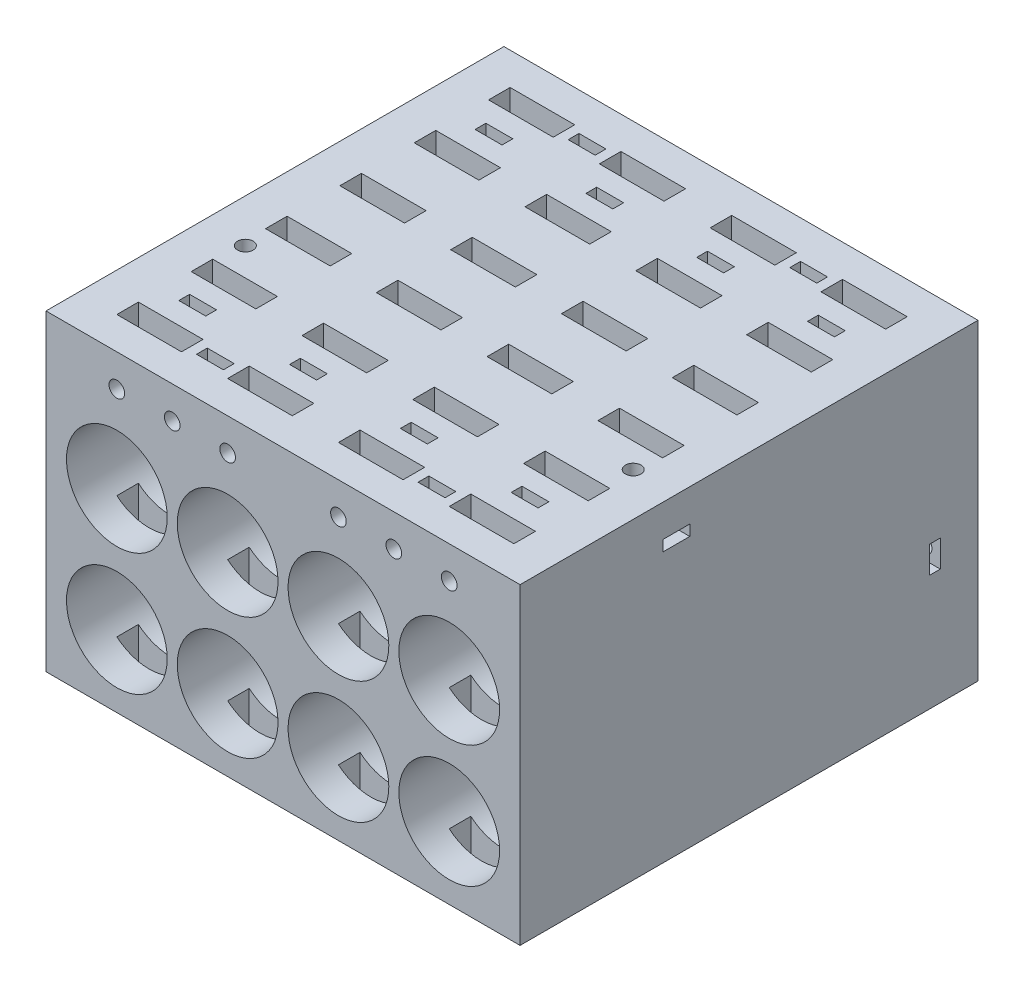
from build123d import *

# Parameters (mm, degrees)
SKETCH1_W                       = 88
SKETCH1_H                       = 58
BOSS_EXTRUDE1_DEPTH             = 10
SKETCH2_W                       = 88
SKETCH2_H                       = 58
SKETCH2_R                       = 9.35
BOSS_EXTRUDE2_DEPTH             = 75
SKETCH3_W                       = 12
SKETCH3_H                       = 4
CUT_EXTRUDE1_DEPTH              = 136.399409157
M2_5_CLEARANCE_HOLE1_D          = 2.9
M2_5_CLEARANCE_HOLE1_DEPTH      = 22
M2_5_CLEARANCE_HOLE1_TIP        = 0.871247898
M2_5_CLEARANCE_HOLE2_D          = 2.9
M2_5_CLEARANCE_HOLE2_DEPTH      = 22
M2_5_CLEARANCE_HOLE2_TIP        = 0.871247898
SKETCH8_W                       = 5
SKETCH8_H                       = 2
CUT_EXTRUDE2_DEPTH              = 10
M2_5_CLEARANCE_HOLE3_AT_2_COUNT = 2
M2_5_CLEARANCE_HOLE3_AT_2_PITCH = 41.133333333
M2_5_CLEARANCE_HOLE4_D          = 2.9
M2_5_CLEARANCE_HOLE4_DEPTH      = 16
M2_5_CLEARANCE_HOLE4_TIP        = 0.871247898
SKETCH13_W                      = 2
SKETCH13_H                      = 5
CUT_EXTRUDE3_DEPTH              = 6
M2_5_CLEARANCE_HOLE5_D          = 2.9
M2_5_CLEARANCE_HOLE5_DEPTH      = 12
M2_5_CLEARANCE_HOLE5_TIP        = 0.871247898
SKETCH16_W                      = 5
SKETCH16_H                      = 2
CUT_EXTRUDE4_DEPTH              = 10
LPATTERN1_COUNT                 = 5
LPATTERN1_PITCH                 = 13.8


with BuildPart() as part:
    # Sketch1 → Boss-Extrude1 (new body)
    with BuildSketch(Plane.XY):
        with Locations((44, 29)):
            Rectangle(SKETCH1_W, SKETCH1_H)
    extrude(amount=BOSS_EXTRUDE1_DEPTH)

    # Sketch2 → Boss-Extrude2 (add)
    with BuildSketch(Plane.XY.offset(10)):
        with Locations((44, 29)):
            Rectangle(SKETCH2_W, SKETCH2_H)
        with Locations((13.15, 13.35)):
            Circle(SKETCH2_R, mode=Mode.SUBTRACT)
        with Locations((33.716666667, 13.35)):
            Circle(SKETCH2_R, mode=Mode.SUBTRACT)
        with Locations((54.283333333, 13.35)):
            Circle(SKETCH2_R, mode=Mode.SUBTRACT)
        with Locations((74.85, 13.35)):
            Circle(SKETCH2_R, mode=Mode.SUBTRACT)
        with Locations((13.15, 36.05)):
            Circle(SKETCH2_R, mode=Mode.SUBTRACT)
        with Locations((33.716666667, 36.05)):
            Circle(SKETCH2_R, mode=Mode.SUBTRACT)
        with Locations((54.283333333, 36.05)):
            Circle(SKETCH2_R, mode=Mode.SUBTRACT)
        with Locations((74.85, 36.05)):
            Circle(SKETCH2_R, mode=Mode.SUBTRACT)
    extrude(amount=BOSS_EXTRUDE2_DEPTH)

    # Sketch3 → Cut-Extrude1 (cut, through all)
    with BuildSketch(Plane.XZ):
        with Locations((74.85, 8)):
            Rectangle(SKETCH3_W, SKETCH3_H)
        with Locations((54.283333333, 8)):
            Rectangle(SKETCH3_W, SKETCH3_H)
        with Locations((33.716666667, 8)):
            Rectangle(SKETCH3_W, SKETCH3_H)
        with Locations((13.15, 8)):
            Rectangle(SKETCH3_W, SKETCH3_H)
        with Locations((13.15, 77)):
            Rectangle(SKETCH3_W, SKETCH3_H)
        with Locations((33.716666667, 77)):
            Rectangle(SKETCH3_W, SKETCH3_H)
        with Locations((54.283333333, 77)):
            Rectangle(SKETCH3_W, SKETCH3_H)
        with Locations((74.85, 77)):
            Rectangle(SKETCH3_W, SKETCH3_H)
    cut_extrude1 = extrude(amount=-CUT_EXTRUDE1_DEPTH, mode=Mode.SUBTRACT)

    # M2.5 Clearance Hole1
    with Locations(Plane.XY.offset(85)):
        with Locations((74.85, 52), (13.15, 52), (33.716666667, 52), (54.283333333, 52)):
            Hole(M2_5_CLEARANCE_HOLE1_D / 2, depth=M2_5_CLEARANCE_HOLE1_DEPTH)
            with Locations((0, 0, -(M2_5_CLEARANCE_HOLE1_DEPTH + M2_5_CLEARANCE_HOLE1_TIP / 2))):  # 118° drill point
                Cone(0, M2_5_CLEARANCE_HOLE1_D / 2, M2_5_CLEARANCE_HOLE1_TIP, mode=Mode.SUBTRACT)

    # M2.5 Clearance Hole2
    with Locations(Plane(origin=(0, 0, 0), x_dir=(-1, 0, 0), z_dir=(0, 0, -1))):
        with Locations((-74.85, 52), (-54.283333333, 52), (-33.716666667, 52), (-13.15, 52)):
            Hole(M2_5_CLEARANCE_HOLE2_D / 2, depth=M2_5_CLEARANCE_HOLE2_DEPTH)
            with Locations((0, 0, -(M2_5_CLEARANCE_HOLE2_DEPTH + M2_5_CLEARANCE_HOLE2_TIP / 2))):  # 118° drill point
                Cone(0, M2_5_CLEARANCE_HOLE2_D / 2, M2_5_CLEARANCE_HOLE2_TIP, mode=Mode.SUBTRACT)

    # Sketch8 → Cut-Extrude2 (cut)
    with BuildSketch(Plane(origin=(0, 58, 0), x_dir=(1, 0, 0), z_dir=(0, 1, 0))):
        with Locations((74.85, -70)):
            Rectangle(SKETCH8_W, SKETCH8_H)
        with Locations((54.283333333, -70)):
            Rectangle(SKETCH8_W, SKETCH8_H)
        with Locations((54.283333333, -15)):
            Rectangle(SKETCH8_W, SKETCH8_H)
        with Locations((74.85, -15)):
            Rectangle(SKETCH8_W, SKETCH8_H)
        with Locations((33.716666667, -15)):
            Rectangle(SKETCH8_W, SKETCH8_H)
        with Locations((13.15, -15)):
            Rectangle(SKETCH8_W, SKETCH8_H)
        with Locations((13.15, -70)):
            Rectangle(SKETCH8_W, SKETCH8_H)
        with Locations((33.716666667, -70)):
            Rectangle(SKETCH8_W, SKETCH8_H)
        with Locations((64.566666667, -8)):
            Rectangle(SKETCH8_W, SKETCH8_H)
        with Locations((23.433333333, -8)):
            Rectangle(SKETCH8_W, SKETCH8_H)
        with Locations((23.433333333, -77)):
            Rectangle(SKETCH8_W, SKETCH8_H)
        with Locations((64.566666667, -77)):
            Rectangle(SKETCH8_W, SKETCH8_H)
    extrude(amount=-CUT_EXTRUDE2_DEPTH, mode=Mode.SUBTRACT)

    # Sketch10 → M2.5 Clearance Hole3 (revolve, cut)
    with BuildSketch(Plane(origin=(64.566666667, 52, 0), x_dir=(0, 1, 0), z_dir=(1, 0, 0))):
        Polygon((0, 0), (0, 16.871247898), (1.45, 16), (1.45, 0), align=None)
    m2_5_clearance_hole3 = revolve(axis=Axis((64.566666667, 52, -6.35), (0, 0, 1)), mode=Mode.SUBTRACT)

    # M2.5 Clearance Hole3 at 2: M2.5 Clearance Hole3 ×2
    with Locations(*[(-i * M2_5_CLEARANCE_HOLE3_AT_2_PITCH, 0, 0) for i in range(1, M2_5_CLEARANCE_HOLE3_AT_2_COUNT)]):
        add(m2_5_clearance_hole3, mode=Mode.SUBTRACT)

    # M2.5 Clearance Hole4
    with Locations(Plane(origin=(0, 0, 0), x_dir=(-1, 0, 0), z_dir=(0, 0, -1))):
        with Locations((-85, 24), (-3, 24)):
            Hole(M2_5_CLEARANCE_HOLE4_D / 2, depth=M2_5_CLEARANCE_HOLE4_DEPTH)
            with Locations((0, 0, -(M2_5_CLEARANCE_HOLE4_DEPTH + M2_5_CLEARANCE_HOLE4_TIP / 2))):  # 118° drill point
                Cone(0, M2_5_CLEARANCE_HOLE4_D / 2, M2_5_CLEARANCE_HOLE4_TIP, mode=Mode.SUBTRACT)

    # Sketch13 → Cut-Extrude3 (cut)
    with BuildSketch(Plane(origin=(88, 0, 0), x_dir=(0, 0, -1), z_dir=(1, 0, 0))):
        with Locations((-8, 24)):
            Rectangle(SKETCH13_W, SKETCH13_H)
    cut_extrude3 = extrude(amount=-CUT_EXTRUDE3_DEPTH, mode=Mode.SUBTRACT)

    # Mirror1: Cut-Extrude3 across plane
    add(cut_extrude3.mirror(Plane(origin=(44, 0, 0), x_dir=(0, 0, 1), z_dir=(1, 0, 0))), mode=Mode.SUBTRACT)

    # M2.5 Clearance Hole5
    with Locations(Plane(origin=(0, 58, 0), x_dir=(1, 0, 0), z_dir=(0, 1, 0))):
        with Locations((80, -56), (8, -56)):
            Hole(M2_5_CLEARANCE_HOLE5_D / 2, depth=M2_5_CLEARANCE_HOLE5_DEPTH)
            with Locations((0, 0, -(M2_5_CLEARANCE_HOLE5_DEPTH + M2_5_CLEARANCE_HOLE5_TIP / 2))):  # 118° drill point
                Cone(0, M2_5_CLEARANCE_HOLE5_D / 2, M2_5_CLEARANCE_HOLE5_TIP, mode=Mode.SUBTRACT)

    # Sketch16 → Cut-Extrude4 (cut)
    with BuildSketch(Plane(origin=(88, 0, 0), x_dir=(0, 0, -1), z_dir=(1, 0, 0))):
        with Locations((-56, 51)):
            Rectangle(SKETCH16_W, SKETCH16_H)
    cut_extrude4 = extrude(amount=-CUT_EXTRUDE4_DEPTH, mode=Mode.SUBTRACT)

    # Mirror2: Cut-Extrude4 across plane
    add(cut_extrude4.mirror(Plane(origin=(44, 0, 0), x_dir=(0, 0, 1), z_dir=(1, 0, 0))), mode=Mode.SUBTRACT)

    # Mirror3: M2.5 Clearance Hole3 across plane
    add(m2_5_clearance_hole3.mirror(Plane(origin=(0, 0, 42.5), x_dir=(1, 0, 0), z_dir=(0, 0, -1))), mode=Mode.SUBTRACT)

    # Mirror3 copy 1 sketch → Mirror3 copy 1 (revolve, cut)
    with BuildSketch(Plane(origin=(23.433333333, 52, 85), x_dir=(0, 1, 0), z_dir=(1, 0, 0))):
        Polygon((0, 0), (0, -16.871247898), (1.45, -16), (1.45, 0), align=None)
    revolve(axis=Axis((23.433333333, 52, 91.35), (0, 0, 1)), mode=Mode.SUBTRACT)

    # LPattern1: Cut-Extrude1 ×5
    with Locations(*[(0, 0, -i * LPATTERN1_PITCH) for i in range(1, LPATTERN1_COUNT)]):
        add(cut_extrude1, mode=Mode.SUBTRACT)


solid = part.part
